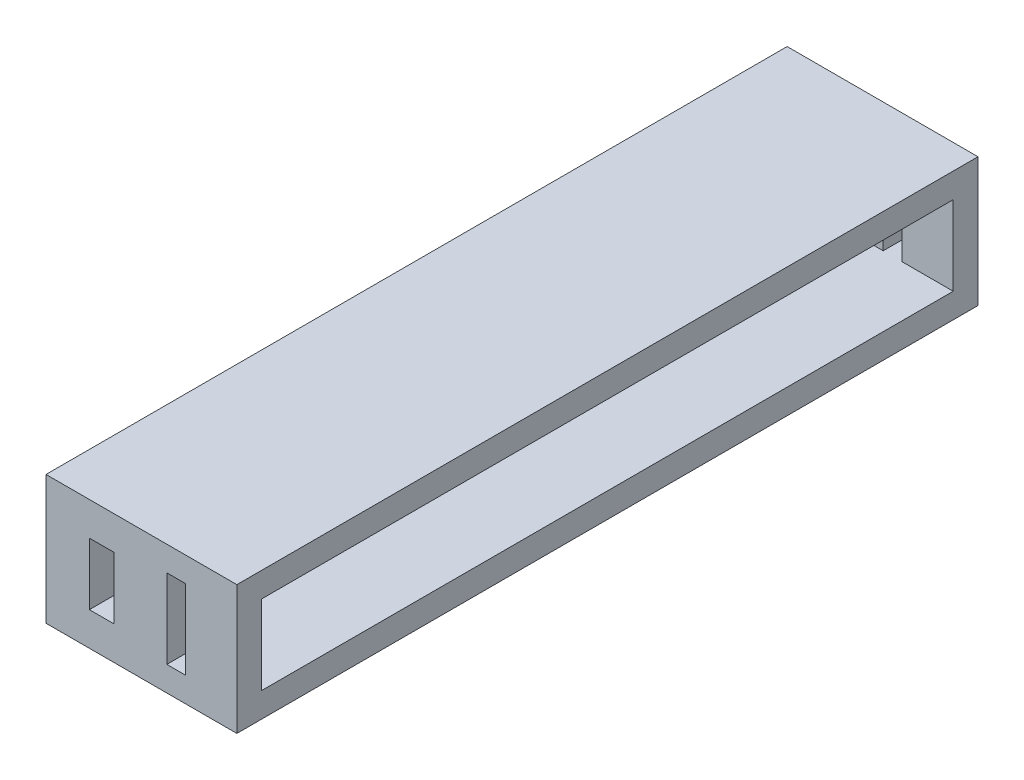
from build123d import *

# Parameters (mm, degrees)
SKETCH2_W               = 111.6
SKETCH2_H               = 12.8
ARM_DEPTH               = 13.4
SHELL_T                 = 4
PIVOT_PEG_HOLE_REACH    = 122.807
SKETCH3_R               = 2.5
CABLE_PASSTHROUGH_REACH = 124.021
SKETCH4_W               = 3
SKETCH4_H               = 12.8
SKETCH4_W_2             = 4
SKETCH4_H_2             = 10


with BuildPart() as part:
    # Sketch2 → arm (new, symmetric)
    with BuildSketch(Plane(origin=(0, 0, 0), x_dir=(0, 0, -1), z_dir=(1, 0, 0))):
        with Locations((55.8, 6.4)):
            Rectangle(SKETCH2_W, SKETCH2_H)
    extrude(amount=ARM_DEPTH, both=True)

    # shell
    shell_openings = [part.faces().sort_by_distance(p)[0] for p in [
        (13.4, 6.4, -55.8),
    ]]
    offset(amount=SHELL_T, openings=shell_openings, kind=Kind.INTERSECTION)

    # Sketch3 → pivot peg hole (cut, up to next)
    with BuildSketch(Plane.ZY.offset(17.4), mode=Mode.PRIVATE) as pivot_peg_hole_sk1:
        with Locations((-5.8, 6.4)):
            Circle(SKETCH3_R)
    pivot_peg_hole_tool1 = extrude(pivot_peg_hole_sk1.sketch, amount=-PIVOT_PEG_HOLE_REACH, mode=Mode.PRIVATE) & part.part
    pivot_peg_hole = pivot_peg_hole_tool1.solids().sort_by_distance((-17.4, 6.4, -5.8))[0]
    add(pivot_peg_hole, mode=Mode.SUBTRACT)

    # Sketch4 → cable passthrough (cut, up to next)
    with BuildSketch(Plane.XY.offset(4), mode=Mode.PRIVATE) as cable_passthrough_sk1:
        with Locations((3.6, 6.4)):
            Rectangle(SKETCH4_W, SKETCH4_H)
    cable_passthrough_tool1 = extrude(cable_passthrough_sk1.sketch, amount=-CABLE_PASSTHROUGH_REACH, mode=Mode.PRIVATE) & part.part
    # Sketch4 → cable passthrough (cut, up to next)
    with BuildSketch(Plane.XY.offset(4), mode=Mode.PRIVATE) as cable_passthrough_sk2:
        with Locations((-8.4, 6.4)):
            Rectangle(SKETCH4_W_2, SKETCH4_H_2)
    cable_passthrough_tool2 = extrude(cable_passthrough_sk2.sketch, amount=-CABLE_PASSTHROUGH_REACH, mode=Mode.PRIVATE) & part.part
    cable_passthrough_1 = cable_passthrough_tool1.solids().sort_by_distance((3.6, 6.4, 4))[0]
    add(cable_passthrough_1, mode=Mode.SUBTRACT)
    cable_passthrough_2 = cable_passthrough_tool2.solids().sort_by_distance((-8.4, 6.4, 4))[0]
    add(cable_passthrough_2, mode=Mode.SUBTRACT)
    cable_passthrough = cable_passthrough_1 + cable_passthrough_2  # cable passthrough as one shape, for the pattern or mirror that repeats it

    # elbow mount: pivot peg hole, cable passthrough across plane
    add(pivot_peg_hole.mirror(Plane.XY.offset(-55.8)), mode=Mode.SUBTRACT)
    add(cable_passthrough.mirror(Plane.XY.offset(-55.8)), mode=Mode.SUBTRACT)


solid = part.part
